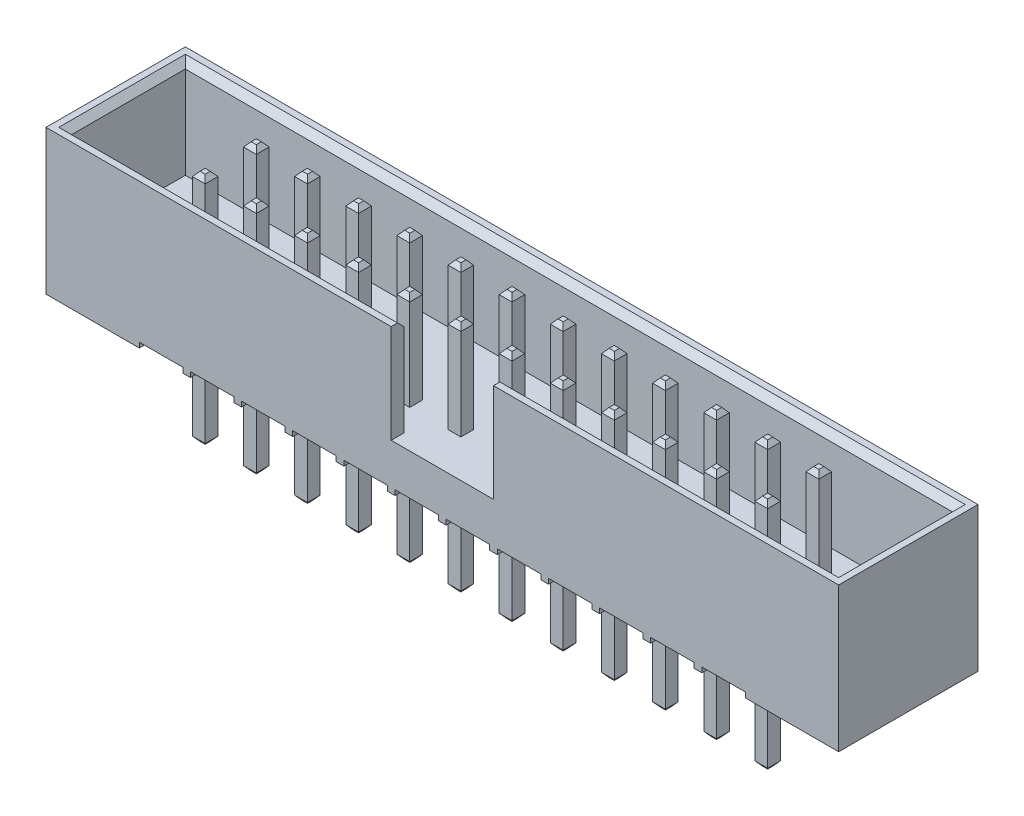
from build123d import *
from OCP.BRepFilletAPI import BRepFilletAPI_MakeChamfer

# Parameters (mm, degrees)
SKETCH_1_W                              = 31
SKETCH_1_H                              = 5.45
EXTRUDE_9143_DEPTH                      = 5.65
SKETCH_6_W                              = 1.7
SKETCH_6_H                              = 0.2
CUT_EXTRUDE_7_DEPTH                     = 32.978508408
PATTERN_LINEAR_3_COUNT                  = 12
PATTERN_LINEAR_3_PITCH                  = 2
SKETCH_2_W                              = 30
SKETCH_2_H                              = 4.45
CUT_EXTRUDE_2_DEPTH                     = 3.85
CUT_EXTRUDE_3_REACH                     = 33.979
SKETCH_3_W                              = 4
SKETCH_3_H                              = 3.85
SKETCH_5_W                              = 0.5
SKETCH_5_H                              = 0.5
EXTRUDE_10759_DEPTH                     = 9.15
CHAMFER_10842_SIZE                      = 0.25
CHAMFER_11163_SIZE                      = 0.15
CHAMFER_11163_SIZE2                     = 0.178763039
PATTERN_LINEAR_2_COUNT                  = 12
PATTERN_LINEAR_2_PITCH                  = 2
CHAMFER_11163_OF_PATTERN_LINEAR_2_SIZE  = 0.15
CHAMFER_11163_OF_PATTERN_LINEAR_2_SIZE2 = 0.178763039


with BuildPart() as part:
    # Эскиз1 → Extrude 9143 (new body)
    with BuildSketch(Plane(origin=(0, 0, 0), x_dir=(1, 0, 0), z_dir=(0, 1, 0))):
        with Locations((15.5, 2.725)):
            Rectangle(SKETCH_1_W, SKETCH_1_H)
    extrude(amount=EXTRUDE_9143_DEPTH)

    # Эскиз6 → Вырез-Вытянуть7 (cut, through all)
    with BuildSketch(Plane.XY):
        with Locations((4.5, 0.1)):
            Rectangle(SKETCH_6_W, SKETCH_6_H)
    cut_extrude_7 = extrude(amount=-CUT_EXTRUDE_7_DEPTH, mode=Mode.SUBTRACT)

    # Линейный массив3: Вырез-Вытянуть7 ×12
    with Locations(*[(i * PATTERN_LINEAR_3_PITCH, 0, 0) for i in range(1, PATTERN_LINEAR_3_COUNT)]):
        add(cut_extrude_7, mode=Mode.SUBTRACT)

    # Эскиз2 → Вырез-Вытянуть2 (cut)
    with BuildSketch(Plane(origin=(0, 5.65, 0), x_dir=(1, 0, 0), z_dir=(0, 1, 0))):
        with Locations((15.5, 2.725)):
            Rectangle(SKETCH_2_W, SKETCH_2_H)
    extrude(amount=-CUT_EXTRUDE_2_DEPTH, mode=Mode.SUBTRACT)

    # Эскиз3 → Вырез-Вытянуть3 (cut, up to next)
    with BuildSketch(Plane.XY, mode=Mode.PRIVATE) as cut_extrude_3_sk1:
        with Locations((15.5, 3.725)):
            Rectangle(SKETCH_3_W, SKETCH_3_H)
    cut_extrude_3_tool1 = extrude(cut_extrude_3_sk1.sketch, amount=-CUT_EXTRUDE_3_REACH, mode=Mode.PRIVATE) & part.part
    add(cut_extrude_3_tool1.solids().sort_by_distance((15.5, 3.725, 0))[0], mode=Mode.SUBTRACT)

    # Эскиз5 → Extrude 10759 (add)
    with BuildSketch(Plane(origin=(0, -3.6, 0), x_dir=(1, 0, 0), z_dir=(0, 1, 0))):
        with Locations((4.5, 1.725)):
            Rectangle(SKETCH_5_W, SKETCH_5_H)
        with Locations((4.5, 3.725)):
            Rectangle(SKETCH_5_W, SKETCH_5_H)
    extrude_10759 = extrude(amount=EXTRUDE_10759_DEPTH)

    # Chamfer 10842
    chamfer_10842_edges = [part.edges().sort_by_distance(p)[0] for p in [
        (0.5, 5.65, -2.725),
        (7, 5.65, -0.5),
        (30.5, 5.65, -2.725),
        (15.5, 5.65, -4.95),
        (24, 5.65, -0.5),
    ]]
    chamfer(chamfer_10842_edges, length=CHAMFER_10842_SIZE)

    # Chamfer 11163: one chamfer whose edges measure the first distance from different faces: ONE call of the kernel's chamfer builder (chamfer() names one face for all edges)
    chamfer_11163_edges_1 = [part.edges().sort_by_distance(p)[0] for p in [
        (4.5, -3.6, -1.475),
        (4.25, -3.6, -1.725),
        (4.5, -3.6, -1.975),
        (4.75, -3.6, -1.725),
    ]]
    chamfer_11163_side_1 = [part.faces().sort_by_distance(p)[0] for p in [
        (4.5, -3.6, -1.725),
    ]]
    chamfer_11163_edges_2 = [part.edges().sort_by_distance(p)[0] for p in [
        (4.5, 5.55, -1.475),
        (4.25, 5.55, -1.725),
        (4.5, 5.55, -1.975),
        (4.75, 5.55, -1.725),
    ]]
    chamfer_11163_side_2 = [part.faces().sort_by_distance(p)[0] for p in [
        (4.5, 5.55, -1.725),
    ]]
    chamfer_11163_edges_3 = [part.edges().sort_by_distance(p)[0] for p in [
        (4.5, -3.6, -3.475),
        (4.25, -3.6, -3.725),
        (4.5, -3.6, -3.975),
        (4.75, -3.6, -3.725),
    ]]
    chamfer_11163_side_3 = [part.faces().sort_by_distance(p)[0] for p in [
        (4.5, -3.6, -3.725),
    ]]
    chamfer_11163_edges_4 = [part.edges().sort_by_distance(p)[0] for p in [
        (4.5, 5.55, -3.475),
        (4.25, 5.55, -3.725),
        (4.5, 5.55, -3.975),
        (4.75, 5.55, -3.725),
    ]]
    chamfer_11163_side_4 = [part.faces().sort_by_distance(p)[0] for p in [
        (4.5, 5.55, -3.725),
    ]]
    chamfer_11163 = BRepFilletAPI_MakeChamfer(part.part.solid().wrapped)
    for e in chamfer_11163_edges_1:
        chamfer_11163.Add(CHAMFER_11163_SIZE, CHAMFER_11163_SIZE2, e.wrapped, chamfer_11163_side_1[0].wrapped)  # the first distance lies on this face
    for e in chamfer_11163_edges_2:
        chamfer_11163.Add(CHAMFER_11163_SIZE, CHAMFER_11163_SIZE2, e.wrapped, chamfer_11163_side_2[0].wrapped)  # the first distance lies on this face
    for e in chamfer_11163_edges_3:
        chamfer_11163.Add(CHAMFER_11163_SIZE, CHAMFER_11163_SIZE2, e.wrapped, chamfer_11163_side_3[0].wrapped)  # the first distance lies on this face
    for e in chamfer_11163_edges_4:
        chamfer_11163.Add(CHAMFER_11163_SIZE, CHAMFER_11163_SIZE2, e.wrapped, chamfer_11163_side_4[0].wrapped)  # the first distance lies on this face
    add(Compound.cast(chamfer_11163.Shape()), mode=Mode.REPLACE)

    # Линейный массив2: Extrude 10759 ×12
    with Locations(*[(i * PATTERN_LINEAR_2_PITCH, 0, 0) for i in range(1, PATTERN_LINEAR_2_COUNT)]):
        add(extrude_10759)

    # Chamfer 11163 of Линейный массив2: one chamfer whose edges measure the first distance from different faces: ONE call of the kernel's chamfer builder (chamfer() names one face for all edges)
    chamfer_11163_of_pattern_linear_2_edges_1 = [part.edges().sort_by_distance(p)[0] for p in [
        (6.5, -3.6, -1.475),
        (6.25, -3.6, -1.725),
        (6.5, -3.6, -1.975),
        (6.75, -3.6, -1.725),
    ]]
    chamfer_11163_of_pattern_linear_2_side_1 = [part.faces().sort_by_distance(p)[0] for p in [
        (6.5, -3.6, -1.725),
    ]]
    chamfer_11163_of_pattern_linear_2_edges_2 = [part.edges().sort_by_distance(p)[0] for p in [
        (6.5, 5.55, -1.475),
        (6.25, 5.55, -1.725),
        (6.5, 5.55, -1.975),
        (6.75, 5.55, -1.725),
    ]]
    chamfer_11163_of_pattern_linear_2_side_2 = [part.faces().sort_by_distance(p)[0] for p in [
        (6.5, 5.55, -1.725),
    ]]
    chamfer_11163_of_pattern_linear_2_edges_3 = [part.edges().sort_by_distance(p)[0] for p in [
        (6.5, -3.6, -3.475),
        (6.25, -3.6, -3.725),
        (6.5, -3.6, -3.975),
        (6.75, -3.6, -3.725),
    ]]
    chamfer_11163_of_pattern_linear_2_side_3 = [part.faces().sort_by_distance(p)[0] for p in [
        (6.5, -3.6, -3.725),
    ]]
    chamfer_11163_of_pattern_linear_2_edges_4 = [part.edges().sort_by_distance(p)[0] for p in [
        (6.5, 5.55, -3.475),
        (6.25, 5.55, -3.725),
        (6.5, 5.55, -3.975),
        (6.75, 5.55, -3.725),
    ]]
    chamfer_11163_of_pattern_linear_2_side_4 = [part.faces().sort_by_distance(p)[0] for p in [
        (6.5, 5.55, -3.725),
    ]]
    chamfer_11163_of_pattern_linear_2_edges_5 = [part.edges().sort_by_distance(p)[0] for p in [
        (8.5, -3.6, -1.475),
        (8.25, -3.6, -1.725),
        (8.5, -3.6, -1.975),
        (8.75, -3.6, -1.725),
    ]]
    chamfer_11163_of_pattern_linear_2_side_5 = [part.faces().sort_by_distance(p)[0] for p in [
        (8.5, -3.6, -1.725),
    ]]
    chamfer_11163_of_pattern_linear_2_edges_6 = [part.edges().sort_by_distance(p)[0] for p in [
        (8.5, 5.55, -1.475),
        (8.25, 5.55, -1.725),
        (8.5, 5.55, -1.975),
        (8.75, 5.55, -1.725),
    ]]
    chamfer_11163_of_pattern_linear_2_side_6 = [part.faces().sort_by_distance(p)[0] for p in [
        (8.5, 5.55, -1.725),
    ]]
    chamfer_11163_of_pattern_linear_2_edges_7 = [part.edges().sort_by_distance(p)[0] for p in [
        (8.5, -3.6, -3.475),
        (8.25, -3.6, -3.725),
        (8.5, -3.6, -3.975),
        (8.75, -3.6, -3.725),
    ]]
    chamfer_11163_of_pattern_linear_2_side_7 = [part.faces().sort_by_distance(p)[0] for p in [
        (8.5, -3.6, -3.725),
    ]]
    chamfer_11163_of_pattern_linear_2_edges_8 = [part.edges().sort_by_distance(p)[0] for p in [
        (8.5, 5.55, -3.475),
        (8.25, 5.55, -3.725),
        (8.5, 5.55, -3.975),
        (8.75, 5.55, -3.725),
    ]]
    chamfer_11163_of_pattern_linear_2_side_8 = [part.faces().sort_by_distance(p)[0] for p in [
        (8.5, 5.55, -3.725),
    ]]
    chamfer_11163_of_pattern_linear_2_edges_9 = [part.edges().sort_by_distance(p)[0] for p in [
        (10.5, -3.6, -1.475),
        (10.25, -3.6, -1.725),
        (10.5, -3.6, -1.975),
        (10.75, -3.6, -1.725),
    ]]
    chamfer_11163_of_pattern_linear_2_side_9 = [part.faces().sort_by_distance(p)[0] for p in [
        (10.5, -3.6, -1.725),
    ]]
    chamfer_11163_of_pattern_linear_2_edges_10 = [part.edges().sort_by_distance(p)[0] for p in [
        (10.5, 5.55, -1.475),
        (10.25, 5.55, -1.725),
        (10.5, 5.55, -1.975),
        (10.75, 5.55, -1.725),
    ]]
    chamfer_11163_of_pattern_linear_2_side_10 = [part.faces().sort_by_distance(p)[0] for p in [
        (10.5, 5.55, -1.725),
    ]]
    chamfer_11163_of_pattern_linear_2_edges_11 = [part.edges().sort_by_distance(p)[0] for p in [
        (10.5, -3.6, -3.475),
        (10.25, -3.6, -3.725),
        (10.5, -3.6, -3.975),
        (10.75, -3.6, -3.725),
    ]]
    chamfer_11163_of_pattern_linear_2_side_11 = [part.faces().sort_by_distance(p)[0] for p in [
        (10.5, -3.6, -3.725),
    ]]
    chamfer_11163_of_pattern_linear_2_edges_12 = [part.edges().sort_by_distance(p)[0] for p in [
        (10.5, 5.55, -3.475),
        (10.25, 5.55, -3.725),
        (10.5, 5.55, -3.975),
        (10.75, 5.55, -3.725),
    ]]
    chamfer_11163_of_pattern_linear_2_side_12 = [part.faces().sort_by_distance(p)[0] for p in [
        (10.5, 5.55, -3.725),
    ]]
    chamfer_11163_of_pattern_linear_2_edges_13 = [part.edges().sort_by_distance(p)[0] for p in [
        (12.5, -3.6, -1.475),
        (12.25, -3.6, -1.725),
        (12.5, -3.6, -1.975),
        (12.75, -3.6, -1.725),
    ]]
    chamfer_11163_of_pattern_linear_2_side_13 = [part.faces().sort_by_distance(p)[0] for p in [
        (12.5, -3.6, -1.725),
    ]]
    chamfer_11163_of_pattern_linear_2_edges_14 = [part.edges().sort_by_distance(p)[0] for p in [
        (12.5, 5.55, -1.475),
        (12.25, 5.55, -1.725),
        (12.5, 5.55, -1.975),
        (12.75, 5.55, -1.725),
    ]]
    chamfer_11163_of_pattern_linear_2_side_14 = [part.faces().sort_by_distance(p)[0] for p in [
        (12.5, 5.55, -1.725),
    ]]
    chamfer_11163_of_pattern_linear_2_edges_15 = [part.edges().sort_by_distance(p)[0] for p in [
        (12.5, -3.6, -3.475),
        (12.25, -3.6, -3.725),
        (12.5, -3.6, -3.975),
        (12.75, -3.6, -3.725),
    ]]
    chamfer_11163_of_pattern_linear_2_side_15 = [part.faces().sort_by_distance(p)[0] for p in [
        (12.5, -3.6, -3.725),
    ]]
    chamfer_11163_of_pattern_linear_2_edges_16 = [part.edges().sort_by_distance(p)[0] for p in [
        (12.5, 5.55, -3.475),
        (12.25, 5.55, -3.725),
        (12.5, 5.55, -3.975),
        (12.75, 5.55, -3.725),
    ]]
    chamfer_11163_of_pattern_linear_2_side_16 = [part.faces().sort_by_distance(p)[0] for p in [
        (12.5, 5.55, -3.725),
    ]]
    chamfer_11163_of_pattern_linear_2_edges_17 = [part.edges().sort_by_distance(p)[0] for p in [
        (14.5, -3.6, -1.475),
        (14.25, -3.6, -1.725),
        (14.5, -3.6, -1.975),
        (14.75, -3.6, -1.725),
    ]]
    chamfer_11163_of_pattern_linear_2_side_17 = [part.faces().sort_by_distance(p)[0] for p in [
        (14.5, -3.6, -1.725),
    ]]
    chamfer_11163_of_pattern_linear_2_edges_18 = [part.edges().sort_by_distance(p)[0] for p in [
        (14.5, 5.55, -1.475),
        (14.25, 5.55, -1.725),
        (14.5, 5.55, -1.975),
        (14.75, 5.55, -1.725),
    ]]
    chamfer_11163_of_pattern_linear_2_side_18 = [part.faces().sort_by_distance(p)[0] for p in [
        (14.5, 5.55, -1.725),
    ]]
    chamfer_11163_of_pattern_linear_2_edges_19 = [part.edges().sort_by_distance(p)[0] for p in [
        (14.5, -3.6, -3.475),
        (14.25, -3.6, -3.725),
        (14.5, -3.6, -3.975),
        (14.75, -3.6, -3.725),
    ]]
    chamfer_11163_of_pattern_linear_2_side_19 = [part.faces().sort_by_distance(p)[0] for p in [
        (14.5, -3.6, -3.725),
    ]]
    chamfer_11163_of_pattern_linear_2_edges_20 = [part.edges().sort_by_distance(p)[0] for p in [
        (14.5, 5.55, -3.475),
        (14.25, 5.55, -3.725),
        (14.5, 5.55, -3.975),
        (14.75, 5.55, -3.725),
    ]]
    chamfer_11163_of_pattern_linear_2_side_20 = [part.faces().sort_by_distance(p)[0] for p in [
        (14.5, 5.55, -3.725),
    ]]
    chamfer_11163_of_pattern_linear_2_edges_21 = [part.edges().sort_by_distance(p)[0] for p in [
        (16.5, -3.6, -1.475),
        (16.25, -3.6, -1.725),
        (16.5, -3.6, -1.975),
        (16.75, -3.6, -1.725),
    ]]
    chamfer_11163_of_pattern_linear_2_side_21 = [part.faces().sort_by_distance(p)[0] for p in [
        (16.5, -3.6, -1.725),
    ]]
    chamfer_11163_of_pattern_linear_2_edges_22 = [part.edges().sort_by_distance(p)[0] for p in [
        (16.5, 5.55, -1.475),
        (16.25, 5.55, -1.725),
        (16.5, 5.55, -1.975),
        (16.75, 5.55, -1.725),
    ]]
    chamfer_11163_of_pattern_linear_2_side_22 = [part.faces().sort_by_distance(p)[0] for p in [
        (16.5, 5.55, -1.725),
    ]]
    chamfer_11163_of_pattern_linear_2_edges_23 = [part.edges().sort_by_distance(p)[0] for p in [
        (16.5, -3.6, -3.475),
        (16.25, -3.6, -3.725),
        (16.5, -3.6, -3.975),
        (16.75, -3.6, -3.725),
    ]]
    chamfer_11163_of_pattern_linear_2_side_23 = [part.faces().sort_by_distance(p)[0] for p in [
        (16.5, -3.6, -3.725),
    ]]
    chamfer_11163_of_pattern_linear_2_edges_24 = [part.edges().sort_by_distance(p)[0] for p in [
        (16.5, 5.55, -3.475),
        (16.25, 5.55, -3.725),
        (16.5, 5.55, -3.975),
        (16.75, 5.55, -3.725),
    ]]
    chamfer_11163_of_pattern_linear_2_side_24 = [part.faces().sort_by_distance(p)[0] for p in [
        (16.5, 5.55, -3.725),
    ]]
    chamfer_11163_of_pattern_linear_2_edges_25 = [part.edges().sort_by_distance(p)[0] for p in [
        (18.5, -3.6, -1.475),
        (18.25, -3.6, -1.725),
        (18.5, -3.6, -1.975),
        (18.75, -3.6, -1.725),
    ]]
    chamfer_11163_of_pattern_linear_2_side_25 = [part.faces().sort_by_distance(p)[0] for p in [
        (18.5, -3.6, -1.725),
    ]]
    chamfer_11163_of_pattern_linear_2_edges_26 = [part.edges().sort_by_distance(p)[0] for p in [
        (18.5, 5.55, -1.475),
        (18.25, 5.55, -1.725),
        (18.5, 5.55, -1.975),
        (18.75, 5.55, -1.725),
    ]]
    chamfer_11163_of_pattern_linear_2_side_26 = [part.faces().sort_by_distance(p)[0] for p in [
        (18.5, 5.55, -1.725),
    ]]
    chamfer_11163_of_pattern_linear_2_edges_27 = [part.edges().sort_by_distance(p)[0] for p in [
        (18.5, -3.6, -3.475),
        (18.25, -3.6, -3.725),
        (18.5, -3.6, -3.975),
        (18.75, -3.6, -3.725),
    ]]
    chamfer_11163_of_pattern_linear_2_side_27 = [part.faces().sort_by_distance(p)[0] for p in [
        (18.5, -3.6, -3.725),
    ]]
    chamfer_11163_of_pattern_linear_2_edges_28 = [part.edges().sort_by_distance(p)[0] for p in [
        (18.5, 5.55, -3.475),
        (18.25, 5.55, -3.725),
        (18.5, 5.55, -3.975),
        (18.75, 5.55, -3.725),
    ]]
    chamfer_11163_of_pattern_linear_2_side_28 = [part.faces().sort_by_distance(p)[0] for p in [
        (18.5, 5.55, -3.725),
    ]]
    chamfer_11163_of_pattern_linear_2_edges_29 = [part.edges().sort_by_distance(p)[0] for p in [
        (20.5, -3.6, -1.475),
        (20.25, -3.6, -1.725),
        (20.5, -3.6, -1.975),
        (20.75, -3.6, -1.725),
    ]]
    chamfer_11163_of_pattern_linear_2_side_29 = [part.faces().sort_by_distance(p)[0] for p in [
        (20.5, -3.6, -1.725),
    ]]
    chamfer_11163_of_pattern_linear_2_edges_30 = [part.edges().sort_by_distance(p)[0] for p in [
        (20.5, 5.55, -1.475),
        (20.25, 5.55, -1.725),
        (20.5, 5.55, -1.975),
        (20.75, 5.55, -1.725),
    ]]
    chamfer_11163_of_pattern_linear_2_side_30 = [part.faces().sort_by_distance(p)[0] for p in [
        (20.5, 5.55, -1.725),
    ]]
    chamfer_11163_of_pattern_linear_2_edges_31 = [part.edges().sort_by_distance(p)[0] for p in [
        (20.5, -3.6, -3.475),
        (20.25, -3.6, -3.725),
        (20.5, -3.6, -3.975),
        (20.75, -3.6, -3.725),
    ]]
    chamfer_11163_of_pattern_linear_2_side_31 = [part.faces().sort_by_distance(p)[0] for p in [
        (20.5, -3.6, -3.725),
    ]]
    chamfer_11163_of_pattern_linear_2_edges_32 = [part.edges().sort_by_distance(p)[0] for p in [
        (20.5, 5.55, -3.475),
        (20.25, 5.55, -3.725),
        (20.5, 5.55, -3.975),
        (20.75, 5.55, -3.725),
    ]]
    chamfer_11163_of_pattern_linear_2_side_32 = [part.faces().sort_by_distance(p)[0] for p in [
        (20.5, 5.55, -3.725),
    ]]
    chamfer_11163_of_pattern_linear_2_edges_33 = [part.edges().sort_by_distance(p)[0] for p in [
        (22.5, -3.6, -1.475),
        (22.25, -3.6, -1.725),
        (22.5, -3.6, -1.975),
        (22.75, -3.6, -1.725),
    ]]
    chamfer_11163_of_pattern_linear_2_side_33 = [part.faces().sort_by_distance(p)[0] for p in [
        (22.5, -3.6, -1.725),
    ]]
    chamfer_11163_of_pattern_linear_2_edges_34 = [part.edges().sort_by_distance(p)[0] for p in [
        (22.5, 5.55, -1.475),
        (22.25, 5.55, -1.725),
        (22.5, 5.55, -1.975),
        (22.75, 5.55, -1.725),
    ]]
    chamfer_11163_of_pattern_linear_2_side_34 = [part.faces().sort_by_distance(p)[0] for p in [
        (22.5, 5.55, -1.725),
    ]]
    chamfer_11163_of_pattern_linear_2_edges_35 = [part.edges().sort_by_distance(p)[0] for p in [
        (22.5, -3.6, -3.475),
        (22.25, -3.6, -3.725),
        (22.5, -3.6, -3.975),
        (22.75, -3.6, -3.725),
    ]]
    chamfer_11163_of_pattern_linear_2_side_35 = [part.faces().sort_by_distance(p)[0] for p in [
        (22.5, -3.6, -3.725),
    ]]
    chamfer_11163_of_pattern_linear_2_edges_36 = [part.edges().sort_by_distance(p)[0] for p in [
        (22.5, 5.55, -3.475),
        (22.25, 5.55, -3.725),
        (22.5, 5.55, -3.975),
        (22.75, 5.55, -3.725),
    ]]
    chamfer_11163_of_pattern_linear_2_side_36 = [part.faces().sort_by_distance(p)[0] for p in [
        (22.5, 5.55, -3.725),
    ]]
    chamfer_11163_of_pattern_linear_2_edges_37 = [part.edges().sort_by_distance(p)[0] for p in [
        (24.5, -3.6, -1.475),
        (24.25, -3.6, -1.725),
        (24.5, -3.6, -1.975),
        (24.75, -3.6, -1.725),
    ]]
    chamfer_11163_of_pattern_linear_2_side_37 = [part.faces().sort_by_distance(p)[0] for p in [
        (24.5, -3.6, -1.725),
    ]]
    chamfer_11163_of_pattern_linear_2_edges_38 = [part.edges().sort_by_distance(p)[0] for p in [
        (24.5, 5.55, -1.475),
        (24.25, 5.55, -1.725),
        (24.5, 5.55, -1.975),
        (24.75, 5.55, -1.725),
    ]]
    chamfer_11163_of_pattern_linear_2_side_38 = [part.faces().sort_by_distance(p)[0] for p in [
        (24.5, 5.55, -1.725),
    ]]
    chamfer_11163_of_pattern_linear_2_edges_39 = [part.edges().sort_by_distance(p)[0] for p in [
        (24.5, -3.6, -3.475),
        (24.25, -3.6, -3.725),
        (24.5, -3.6, -3.975),
        (24.75, -3.6, -3.725),
    ]]
    chamfer_11163_of_pattern_linear_2_side_39 = [part.faces().sort_by_distance(p)[0] for p in [
        (24.5, -3.6, -3.725),
    ]]
    chamfer_11163_of_pattern_linear_2_edges_40 = [part.edges().sort_by_distance(p)[0] for p in [
        (24.5, 5.55, -3.475),
        (24.25, 5.55, -3.725),
        (24.5, 5.55, -3.975),
        (24.75, 5.55, -3.725),
    ]]
    chamfer_11163_of_pattern_linear_2_side_40 = [part.faces().sort_by_distance(p)[0] for p in [
        (24.5, 5.55, -3.725),
    ]]
    chamfer_11163_of_pattern_linear_2_edges_41 = [part.edges().sort_by_distance(p)[0] for p in [
        (26.5, -3.6, -1.475),
        (26.25, -3.6, -1.725),
        (26.5, -3.6, -1.975),
        (26.75, -3.6, -1.725),
    ]]
    chamfer_11163_of_pattern_linear_2_side_41 = [part.faces().sort_by_distance(p)[0] for p in [
        (26.5, -3.6, -1.725),
    ]]
    chamfer_11163_of_pattern_linear_2_edges_42 = [part.edges().sort_by_distance(p)[0] for p in [
        (26.5, 5.55, -1.475),
        (26.25, 5.55, -1.725),
        (26.5, 5.55, -1.975),
        (26.75, 5.55, -1.725),
    ]]
    chamfer_11163_of_pattern_linear_2_side_42 = [part.faces().sort_by_distance(p)[0] for p in [
        (26.5, 5.55, -1.725),
    ]]
    chamfer_11163_of_pattern_linear_2_edges_43 = [part.edges().sort_by_distance(p)[0] for p in [
        (26.5, -3.6, -3.475),
        (26.25, -3.6, -3.725),
        (26.5, -3.6, -3.975),
        (26.75, -3.6, -3.725),
    ]]
    chamfer_11163_of_pattern_linear_2_side_43 = [part.faces().sort_by_distance(p)[0] for p in [
        (26.5, -3.6, -3.725),
    ]]
    chamfer_11163_of_pattern_linear_2_edges_44 = [part.edges().sort_by_distance(p)[0] for p in [
        (26.5, 5.55, -3.475),
        (26.25, 5.55, -3.725),
        (26.5, 5.55, -3.975),
        (26.75, 5.55, -3.725),
    ]]
    chamfer_11163_of_pattern_linear_2_side_44 = [part.faces().sort_by_distance(p)[0] for p in [
        (26.5, 5.55, -3.725),
    ]]
    chamfer_11163_of_pattern_linear_2 = BRepFilletAPI_MakeChamfer(part.part.solid().wrapped)
    for e in chamfer_11163_of_pattern_linear_2_edges_1:
        chamfer_11163_of_pattern_linear_2.Add(CHAMFER_11163_OF_PATTERN_LINEAR_2_SIZE, CHAMFER_11163_OF_PATTERN_LINEAR_2_SIZE2, e.wrapped, chamfer_11163_of_pattern_linear_2_side_1[0].wrapped)  # the first distance lies on this face
    for e in chamfer_11163_of_pattern_linear_2_edges_2:
        chamfer_11163_of_pattern_linear_2.Add(CHAMFER_11163_OF_PATTERN_LINEAR_2_SIZE, CHAMFER_11163_OF_PATTERN_LINEAR_2_SIZE2, e.wrapped, chamfer_11163_of_pattern_linear_2_side_2[0].wrapped)  # the first distance lies on this face
    for e in chamfer_11163_of_pattern_linear_2_edges_3:
        chamfer_11163_of_pattern_linear_2.Add(CHAMFER_11163_OF_PATTERN_LINEAR_2_SIZE, CHAMFER_11163_OF_PATTERN_LINEAR_2_SIZE2, e.wrapped, chamfer_11163_of_pattern_linear_2_side_3[0].wrapped)  # the first distance lies on this face
    for e in chamfer_11163_of_pattern_linear_2_edges_4:
        chamfer_11163_of_pattern_linear_2.Add(CHAMFER_11163_OF_PATTERN_LINEAR_2_SIZE, CHAMFER_11163_OF_PATTERN_LINEAR_2_SIZE2, e.wrapped, chamfer_11163_of_pattern_linear_2_side_4[0].wrapped)  # the first distance lies on this face
    for e in chamfer_11163_of_pattern_linear_2_edges_5:
        chamfer_11163_of_pattern_linear_2.Add(CHAMFER_11163_OF_PATTERN_LINEAR_2_SIZE, CHAMFER_11163_OF_PATTERN_LINEAR_2_SIZE2, e.wrapped, chamfer_11163_of_pattern_linear_2_side_5[0].wrapped)  # the first distance lies on this face
    for e in chamfer_11163_of_pattern_linear_2_edges_6:
        chamfer_11163_of_pattern_linear_2.Add(CHAMFER_11163_OF_PATTERN_LINEAR_2_SIZE, CHAMFER_11163_OF_PATTERN_LINEAR_2_SIZE2, e.wrapped, chamfer_11163_of_pattern_linear_2_side_6[0].wrapped)  # the first distance lies on this face
    for e in chamfer_11163_of_pattern_linear_2_edges_7:
        chamfer_11163_of_pattern_linear_2.Add(CHAMFER_11163_OF_PATTERN_LINEAR_2_SIZE, CHAMFER_11163_OF_PATTERN_LINEAR_2_SIZE2, e.wrapped, chamfer_11163_of_pattern_linear_2_side_7[0].wrapped)  # the first distance lies on this face
    for e in chamfer_11163_of_pattern_linear_2_edges_8:
        chamfer_11163_of_pattern_linear_2.Add(CHAMFER_11163_OF_PATTERN_LINEAR_2_SIZE, CHAMFER_11163_OF_PATTERN_LINEAR_2_SIZE2, e.wrapped, chamfer_11163_of_pattern_linear_2_side_8[0].wrapped)  # the first distance lies on this face
    for e in chamfer_11163_of_pattern_linear_2_edges_9:
        chamfer_11163_of_pattern_linear_2.Add(CHAMFER_11163_OF_PATTERN_LINEAR_2_SIZE, CHAMFER_11163_OF_PATTERN_LINEAR_2_SIZE2, e.wrapped, chamfer_11163_of_pattern_linear_2_side_9[0].wrapped)  # the first distance lies on this face
    for e in chamfer_11163_of_pattern_linear_2_edges_10:
        chamfer_11163_of_pattern_linear_2.Add(CHAMFER_11163_OF_PATTERN_LINEAR_2_SIZE, CHAMFER_11163_OF_PATTERN_LINEAR_2_SIZE2, e.wrapped, chamfer_11163_of_pattern_linear_2_side_10[0].wrapped)  # the first distance lies on this face
    for e in chamfer_11163_of_pattern_linear_2_edges_11:
        chamfer_11163_of_pattern_linear_2.Add(CHAMFER_11163_OF_PATTERN_LINEAR_2_SIZE, CHAMFER_11163_OF_PATTERN_LINEAR_2_SIZE2, e.wrapped, chamfer_11163_of_pattern_linear_2_side_11[0].wrapped)  # the first distance lies on this face
    for e in chamfer_11163_of_pattern_linear_2_edges_12:
        chamfer_11163_of_pattern_linear_2.Add(CHAMFER_11163_OF_PATTERN_LINEAR_2_SIZE, CHAMFER_11163_OF_PATTERN_LINEAR_2_SIZE2, e.wrapped, chamfer_11163_of_pattern_linear_2_side_12[0].wrapped)  # the first distance lies on this face
    for e in chamfer_11163_of_pattern_linear_2_edges_13:
        chamfer_11163_of_pattern_linear_2.Add(CHAMFER_11163_OF_PATTERN_LINEAR_2_SIZE, CHAMFER_11163_OF_PATTERN_LINEAR_2_SIZE2, e.wrapped, chamfer_11163_of_pattern_linear_2_side_13[0].wrapped)  # the first distance lies on this face
    for e in chamfer_11163_of_pattern_linear_2_edges_14:
        chamfer_11163_of_pattern_linear_2.Add(CHAMFER_11163_OF_PATTERN_LINEAR_2_SIZE, CHAMFER_11163_OF_PATTERN_LINEAR_2_SIZE2, e.wrapped, chamfer_11163_of_pattern_linear_2_side_14[0].wrapped)  # the first distance lies on this face
    for e in chamfer_11163_of_pattern_linear_2_edges_15:
        chamfer_11163_of_pattern_linear_2.Add(CHAMFER_11163_OF_PATTERN_LINEAR_2_SIZE, CHAMFER_11163_OF_PATTERN_LINEAR_2_SIZE2, e.wrapped, chamfer_11163_of_pattern_linear_2_side_15[0].wrapped)  # the first distance lies on this face
    for e in chamfer_11163_of_pattern_linear_2_edges_16:
        chamfer_11163_of_pattern_linear_2.Add(CHAMFER_11163_OF_PATTERN_LINEAR_2_SIZE, CHAMFER_11163_OF_PATTERN_LINEAR_2_SIZE2, e.wrapped, chamfer_11163_of_pattern_linear_2_side_16[0].wrapped)  # the first distance lies on this face
    for e in chamfer_11163_of_pattern_linear_2_edges_17:
        chamfer_11163_of_pattern_linear_2.Add(CHAMFER_11163_OF_PATTERN_LINEAR_2_SIZE, CHAMFER_11163_OF_PATTERN_LINEAR_2_SIZE2, e.wrapped, chamfer_11163_of_pattern_linear_2_side_17[0].wrapped)  # the first distance lies on this face
    for e in chamfer_11163_of_pattern_linear_2_edges_18:
        chamfer_11163_of_pattern_linear_2.Add(CHAMFER_11163_OF_PATTERN_LINEAR_2_SIZE, CHAMFER_11163_OF_PATTERN_LINEAR_2_SIZE2, e.wrapped, chamfer_11163_of_pattern_linear_2_side_18[0].wrapped)  # the first distance lies on this face
    for e in chamfer_11163_of_pattern_linear_2_edges_19:
        chamfer_11163_of_pattern_linear_2.Add(CHAMFER_11163_OF_PATTERN_LINEAR_2_SIZE, CHAMFER_11163_OF_PATTERN_LINEAR_2_SIZE2, e.wrapped, chamfer_11163_of_pattern_linear_2_side_19[0].wrapped)  # the first distance lies on this face
    for e in chamfer_11163_of_pattern_linear_2_edges_20:
        chamfer_11163_of_pattern_linear_2.Add(CHAMFER_11163_OF_PATTERN_LINEAR_2_SIZE, CHAMFER_11163_OF_PATTERN_LINEAR_2_SIZE2, e.wrapped, chamfer_11163_of_pattern_linear_2_side_20[0].wrapped)  # the first distance lies on this face
    for e in chamfer_11163_of_pattern_linear_2_edges_21:
        chamfer_11163_of_pattern_linear_2.Add(CHAMFER_11163_OF_PATTERN_LINEAR_2_SIZE, CHAMFER_11163_OF_PATTERN_LINEAR_2_SIZE2, e.wrapped, chamfer_11163_of_pattern_linear_2_side_21[0].wrapped)  # the first distance lies on this face
    for e in chamfer_11163_of_pattern_linear_2_edges_22:
        chamfer_11163_of_pattern_linear_2.Add(CHAMFER_11163_OF_PATTERN_LINEAR_2_SIZE, CHAMFER_11163_OF_PATTERN_LINEAR_2_SIZE2, e.wrapped, chamfer_11163_of_pattern_linear_2_side_22[0].wrapped)  # the first distance lies on this face
    for e in chamfer_11163_of_pattern_linear_2_edges_23:
        chamfer_11163_of_pattern_linear_2.Add(CHAMFER_11163_OF_PATTERN_LINEAR_2_SIZE, CHAMFER_11163_OF_PATTERN_LINEAR_2_SIZE2, e.wrapped, chamfer_11163_of_pattern_linear_2_side_23[0].wrapped)  # the first distance lies on this face
    for e in chamfer_11163_of_pattern_linear_2_edges_24:
        chamfer_11163_of_pattern_linear_2.Add(CHAMFER_11163_OF_PATTERN_LINEAR_2_SIZE, CHAMFER_11163_OF_PATTERN_LINEAR_2_SIZE2, e.wrapped, chamfer_11163_of_pattern_linear_2_side_24[0].wrapped)  # the first distance lies on this face
    for e in chamfer_11163_of_pattern_linear_2_edges_25:
        chamfer_11163_of_pattern_linear_2.Add(CHAMFER_11163_OF_PATTERN_LINEAR_2_SIZE, CHAMFER_11163_OF_PATTERN_LINEAR_2_SIZE2, e.wrapped, chamfer_11163_of_pattern_linear_2_side_25[0].wrapped)  # the first distance lies on this face
    for e in chamfer_11163_of_pattern_linear_2_edges_26:
        chamfer_11163_of_pattern_linear_2.Add(CHAMFER_11163_OF_PATTERN_LINEAR_2_SIZE, CHAMFER_11163_OF_PATTERN_LINEAR_2_SIZE2, e.wrapped, chamfer_11163_of_pattern_linear_2_side_26[0].wrapped)  # the first distance lies on this face
    for e in chamfer_11163_of_pattern_linear_2_edges_27:
        chamfer_11163_of_pattern_linear_2.Add(CHAMFER_11163_OF_PATTERN_LINEAR_2_SIZE, CHAMFER_11163_OF_PATTERN_LINEAR_2_SIZE2, e.wrapped, chamfer_11163_of_pattern_linear_2_side_27[0].wrapped)  # the first distance lies on this face
    for e in chamfer_11163_of_pattern_linear_2_edges_28:
        chamfer_11163_of_pattern_linear_2.Add(CHAMFER_11163_OF_PATTERN_LINEAR_2_SIZE, CHAMFER_11163_OF_PATTERN_LINEAR_2_SIZE2, e.wrapped, chamfer_11163_of_pattern_linear_2_side_28[0].wrapped)  # the first distance lies on this face
    for e in chamfer_11163_of_pattern_linear_2_edges_29:
        chamfer_11163_of_pattern_linear_2.Add(CHAMFER_11163_OF_PATTERN_LINEAR_2_SIZE, CHAMFER_11163_OF_PATTERN_LINEAR_2_SIZE2, e.wrapped, chamfer_11163_of_pattern_linear_2_side_29[0].wrapped)  # the first distance lies on this face
    for e in chamfer_11163_of_pattern_linear_2_edges_30:
        chamfer_11163_of_pattern_linear_2.Add(CHAMFER_11163_OF_PATTERN_LINEAR_2_SIZE, CHAMFER_11163_OF_PATTERN_LINEAR_2_SIZE2, e.wrapped, chamfer_11163_of_pattern_linear_2_side_30[0].wrapped)  # the first distance lies on this face
    for e in chamfer_11163_of_pattern_linear_2_edges_31:
        chamfer_11163_of_pattern_linear_2.Add(CHAMFER_11163_OF_PATTERN_LINEAR_2_SIZE, CHAMFER_11163_OF_PATTERN_LINEAR_2_SIZE2, e.wrapped, chamfer_11163_of_pattern_linear_2_side_31[0].wrapped)  # the first distance lies on this face
    for e in chamfer_11163_of_pattern_linear_2_edges_32:
        chamfer_11163_of_pattern_linear_2.Add(CHAMFER_11163_OF_PATTERN_LINEAR_2_SIZE, CHAMFER_11163_OF_PATTERN_LINEAR_2_SIZE2, e.wrapped, chamfer_11163_of_pattern_linear_2_side_32[0].wrapped)  # the first distance lies on this face
    for e in chamfer_11163_of_pattern_linear_2_edges_33:
        chamfer_11163_of_pattern_linear_2.Add(CHAMFER_11163_OF_PATTERN_LINEAR_2_SIZE, CHAMFER_11163_OF_PATTERN_LINEAR_2_SIZE2, e.wrapped, chamfer_11163_of_pattern_linear_2_side_33[0].wrapped)  # the first distance lies on this face
    for e in chamfer_11163_of_pattern_linear_2_edges_34:
        chamfer_11163_of_pattern_linear_2.Add(CHAMFER_11163_OF_PATTERN_LINEAR_2_SIZE, CHAMFER_11163_OF_PATTERN_LINEAR_2_SIZE2, e.wrapped, chamfer_11163_of_pattern_linear_2_side_34[0].wrapped)  # the first distance lies on this face
    for e in chamfer_11163_of_pattern_linear_2_edges_35:
        chamfer_11163_of_pattern_linear_2.Add(CHAMFER_11163_OF_PATTERN_LINEAR_2_SIZE, CHAMFER_11163_OF_PATTERN_LINEAR_2_SIZE2, e.wrapped, chamfer_11163_of_pattern_linear_2_side_35[0].wrapped)  # the first distance lies on this face
    for e in chamfer_11163_of_pattern_linear_2_edges_36:
        chamfer_11163_of_pattern_linear_2.Add(CHAMFER_11163_OF_PATTERN_LINEAR_2_SIZE, CHAMFER_11163_OF_PATTERN_LINEAR_2_SIZE2, e.wrapped, chamfer_11163_of_pattern_linear_2_side_36[0].wrapped)  # the first distance lies on this face
    for e in chamfer_11163_of_pattern_linear_2_edges_37:
        chamfer_11163_of_pattern_linear_2.Add(CHAMFER_11163_OF_PATTERN_LINEAR_2_SIZE, CHAMFER_11163_OF_PATTERN_LINEAR_2_SIZE2, e.wrapped, chamfer_11163_of_pattern_linear_2_side_37[0].wrapped)  # the first distance lies on this face
    for e in chamfer_11163_of_pattern_linear_2_edges_38:
        chamfer_11163_of_pattern_linear_2.Add(CHAMFER_11163_OF_PATTERN_LINEAR_2_SIZE, CHAMFER_11163_OF_PATTERN_LINEAR_2_SIZE2, e.wrapped, chamfer_11163_of_pattern_linear_2_side_38[0].wrapped)  # the first distance lies on this face
    for e in chamfer_11163_of_pattern_linear_2_edges_39:
        chamfer_11163_of_pattern_linear_2.Add(CHAMFER_11163_OF_PATTERN_LINEAR_2_SIZE, CHAMFER_11163_OF_PATTERN_LINEAR_2_SIZE2, e.wrapped, chamfer_11163_of_pattern_linear_2_side_39[0].wrapped)  # the first distance lies on this face
    for e in chamfer_11163_of_pattern_linear_2_edges_40:
        chamfer_11163_of_pattern_linear_2.Add(CHAMFER_11163_OF_PATTERN_LINEAR_2_SIZE, CHAMFER_11163_OF_PATTERN_LINEAR_2_SIZE2, e.wrapped, chamfer_11163_of_pattern_linear_2_side_40[0].wrapped)  # the first distance lies on this face
    for e in chamfer_11163_of_pattern_linear_2_edges_41:
        chamfer_11163_of_pattern_linear_2.Add(CHAMFER_11163_OF_PATTERN_LINEAR_2_SIZE, CHAMFER_11163_OF_PATTERN_LINEAR_2_SIZE2, e.wrapped, chamfer_11163_of_pattern_linear_2_side_41[0].wrapped)  # the first distance lies on this face
    for e in chamfer_11163_of_pattern_linear_2_edges_42:
        chamfer_11163_of_pattern_linear_2.Add(CHAMFER_11163_OF_PATTERN_LINEAR_2_SIZE, CHAMFER_11163_OF_PATTERN_LINEAR_2_SIZE2, e.wrapped, chamfer_11163_of_pattern_linear_2_side_42[0].wrapped)  # the first distance lies on this face
    for e in chamfer_11163_of_pattern_linear_2_edges_43:
        chamfer_11163_of_pattern_linear_2.Add(CHAMFER_11163_OF_PATTERN_LINEAR_2_SIZE, CHAMFER_11163_OF_PATTERN_LINEAR_2_SIZE2, e.wrapped, chamfer_11163_of_pattern_linear_2_side_43[0].wrapped)  # the first distance lies on this face
    for e in chamfer_11163_of_pattern_linear_2_edges_44:
        chamfer_11163_of_pattern_linear_2.Add(CHAMFER_11163_OF_PATTERN_LINEAR_2_SIZE, CHAMFER_11163_OF_PATTERN_LINEAR_2_SIZE2, e.wrapped, chamfer_11163_of_pattern_linear_2_side_44[0].wrapped)  # the first distance lies on this face
    add(Compound.cast(chamfer_11163_of_pattern_linear_2.Shape()), mode=Mode.REPLACE)


solid = part.part
